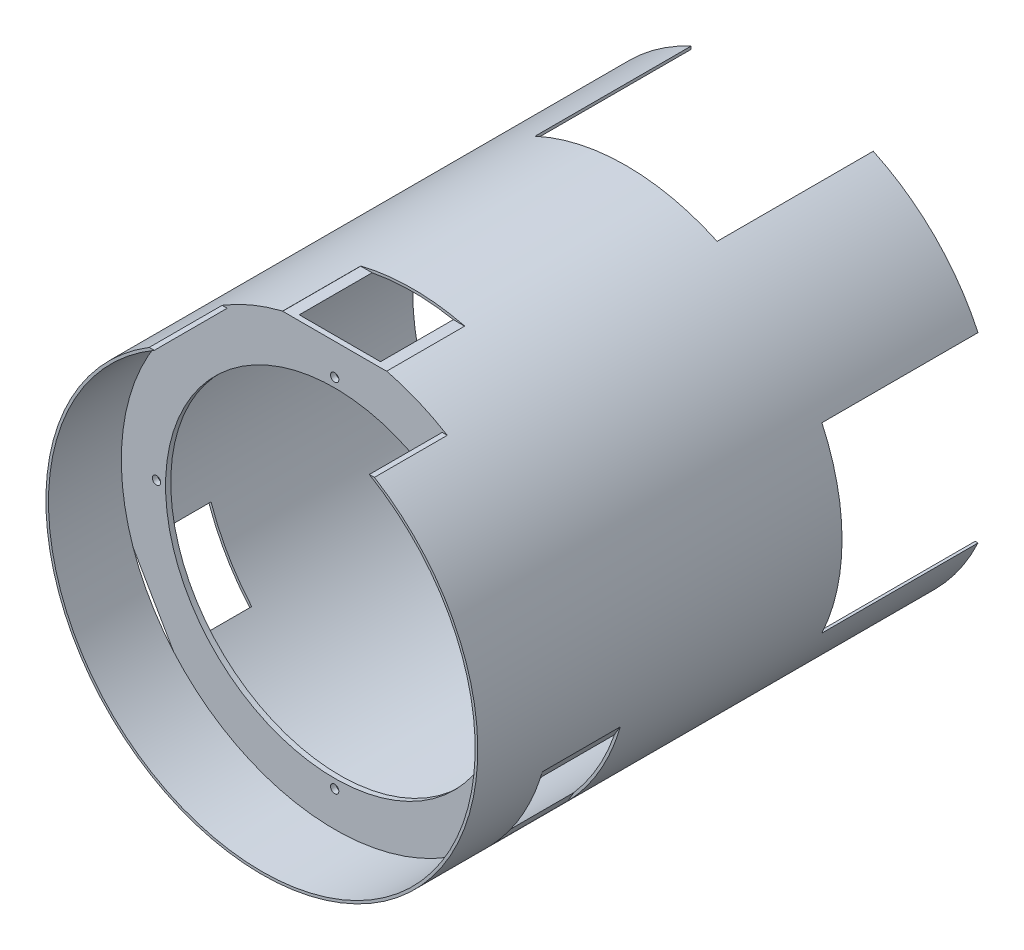
from build123d import *

# Parameters (mm, degrees)
EXTRUDE_1_DEPTH          = 100
EXTRUDE_1_DEPTH_BACK     = 100
SKETCH_1_R               = 83
SHELL_1_T                = -1
SKETCH_2_R               = 82.5
SKETCH_2_R_2             = 65
EXTRUDE_2_DEPTH          = 2
CUT_EXTRUDE_1_DEPTH      = 28
SKETCH_5_W               = 70
SKETCH_5_H               = 60
CUT_EXTRUDE_2_DEPTH      = 155.201167311
PATTERN_CIRCULAR_1_COUNT = 4
SKETCH_6_W               = 40
SKETCH_6_H               = 5
CUT_EXTRUDE_3_DEPTH      = 30
CUT_EXTRUDE_4_REACH      = 210.235
SKETCH_7_R               = 1.6


with BuildPart() as part:
    # 草图1 → 凸台-拉伸1 (new, two sides: drawn at the far end of the back side and taken through both)
    with BuildSketch(Plane.XY.offset(-EXTRUDE_1_DEPTH_BACK)):
        Circle(SKETCH_1_R)
    extrude(amount=EXTRUDE_1_DEPTH + EXTRUDE_1_DEPTH_BACK)

    # 抽壳1
    shell_1_openings = [part.faces().sort_by_distance(p)[0] for p in [
        (0, 0, -100),
        (0, 0, 100),
    ]]
    offset(amount=SHELL_1_T, openings=shell_1_openings, kind=Kind.INTERSECTION)

    # 草图2 → 凸台-拉伸2 (add)
    with BuildSketch(Plane.XY.offset(70)):
        Circle(SKETCH_2_R)
        Circle(SKETCH_2_R_2, mode=Mode.SUBTRACT)
    extrude(amount=EXTRUDE_2_DEPTH)

    # 草图3 → 切除-拉伸1 (cut)
    with BuildSketch(Plane.XY.offset(100)):
        with BuildLine():
            Line((43.273355415, 70.826666667), (-43.273355415, 70.826666667))
            ThreePointArc((-43.273355415, 70.826666667), (0, 83), (43.273355415, 70.826666667))
        make_face()
    extrude(amount=-CUT_EXTRUDE_1_DEPTH, mode=Mode.SUBTRACT)

    # 草图5 → 切除-拉伸2 (cut, symmetric)
    with BuildSketch(Plane(origin=(0, 0, 0), x_dir=(1, 0, 0), z_dir=(0, 1, 0))):
        with Locations((0, 70)):
            Rectangle(SKETCH_5_W, SKETCH_5_H)
    cut_extrude_2 = extrude(amount=CUT_EXTRUDE_2_DEPTH, both=True, mode=Mode.SUBTRACT)

    # 阵列(圆周)1: 切除-拉伸2 ×4 about axis
    pattern_circular_1_axis = Axis((0, 0, -100), (0, 0, 1))
    for i in range(1, PATTERN_CIRCULAR_1_COUNT):
        add(cut_extrude_2.rotate(pattern_circular_1_axis, i * 360 / PATTERN_CIRCULAR_1_COUNT), mode=Mode.SUBTRACT)

    # 草图6 → 切除-拉伸3 (cut)
    with BuildSketch(Plane(origin=(0, 0, 72), x_dir=(1, 0, 0), z_dir=(0, 0, -1))):
        Polygon((-64.045172024, 60.070508076), (-84.045172024, 25.429491924), (-79.715045005, 22.929491924), (-59.715045005, 57.570508076), align=None)
        with Locations((0, -83)):
            Rectangle(SKETCH_6_W, SKETCH_6_H)
        Polygon((84.045172024, 25.429491924), (64.045172024, 60.070508076), (59.715045005, 57.570508076), (79.715045005, 22.929491924), align=None)
    extrude(amount=CUT_EXTRUDE_3_DEPTH, mode=Mode.SUBTRACT)

    # 草图7 → 切除-拉伸4 (cut, up to next)
    with BuildSketch(Plane.XY.offset(72), mode=Mode.PRIVATE) as cut_extrude_4_sk1:
        with Locations((0, 68.5)):
            Circle(SKETCH_7_R)
    cut_extrude_4_tool1 = extrude(cut_extrude_4_sk1.sketch, amount=-CUT_EXTRUDE_4_REACH, mode=Mode.PRIVATE) & part.part
    # 草图7 → 切除-拉伸4 (cut, up to next)
    with BuildSketch(Plane.XY.offset(72), mode=Mode.PRIVATE) as cut_extrude_4_sk2:
        with Locations((-68.5, 0)):
            Circle(SKETCH_7_R)
    cut_extrude_4_tool2 = extrude(cut_extrude_4_sk2.sketch, amount=-CUT_EXTRUDE_4_REACH, mode=Mode.PRIVATE) & part.part
    # 草图7 → 切除-拉伸4 (cut, up to next)
    with BuildSketch(Plane.XY.offset(72), mode=Mode.PRIVATE) as cut_extrude_4_sk3:
        with Locations((0, -68.5)):
            Circle(SKETCH_7_R)
    cut_extrude_4_tool3 = extrude(cut_extrude_4_sk3.sketch, amount=-CUT_EXTRUDE_4_REACH, mode=Mode.PRIVATE) & part.part
    # 草图7 → 切除-拉伸4 (cut, up to next)
    with BuildSketch(Plane.XY.offset(72), mode=Mode.PRIVATE) as cut_extrude_4_sk4:
        with Locations((68.5, 0)):
            Circle(SKETCH_7_R)
    cut_extrude_4_tool4 = extrude(cut_extrude_4_sk4.sketch, amount=-CUT_EXTRUDE_4_REACH, mode=Mode.PRIVATE) & part.part
    add(cut_extrude_4_tool1.solids().sort_by_distance((0, 68.5, 72))[0], mode=Mode.SUBTRACT)
    add(cut_extrude_4_tool2.solids().sort_by_distance((-68.5, 0, 72))[0], mode=Mode.SUBTRACT)
    add(cut_extrude_4_tool3.solids().sort_by_distance((0, -68.5, 72))[0], mode=Mode.SUBTRACT)
    add(cut_extrude_4_tool4.solids().sort_by_distance((68.5, 0, 72))[0], mode=Mode.SUBTRACT)


solid = part.part
